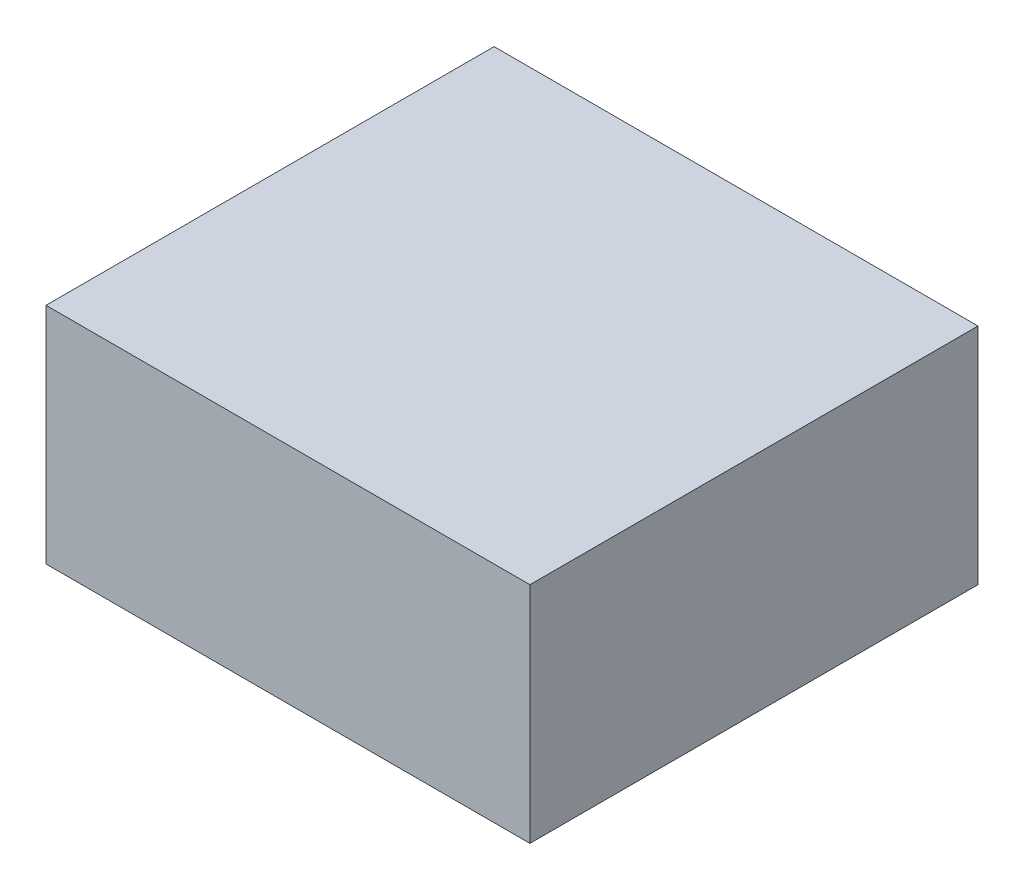
from build123d import *

# Parameters (mm, degrees)
PRESS_PZP400_MOTOR_REZISTANS_GOVDESI_1_START = -250
SKETCH1_W                                    = 540
SKETCH1_H                                    = 250
PRESS_PZP400_MOTOR_REZISTANS_GOVDESI_1_DEPTH = 500


with BuildPart() as part:
    # Sketch1 → PRESS_PZP400_motor_rezistans_govdesi_1 (new body)
    with BuildSketch(Plane.XY.offset(PRESS_PZP400_MOTOR_REZISTANS_GOVDESI_1_START)):
        with Locations((350, 275)):
            Rectangle(SKETCH1_W, SKETCH1_H)
    extrude(amount=-PRESS_PZP400_MOTOR_REZISTANS_GOVDESI_1_DEPTH)


solid = part.part
